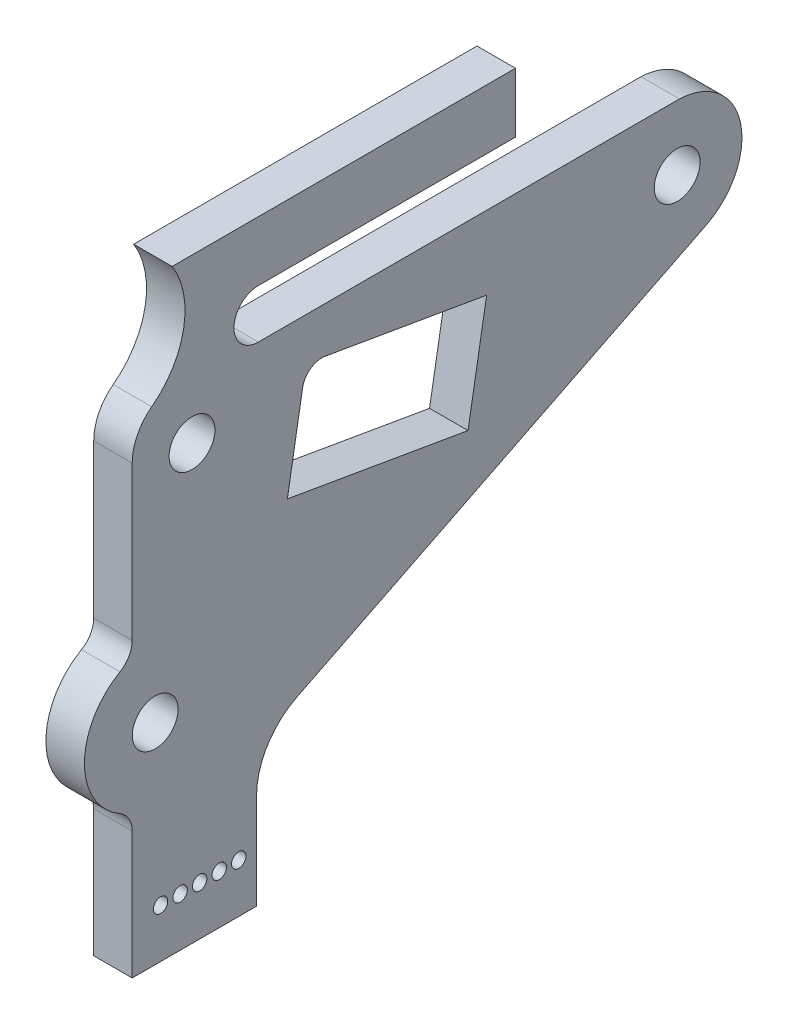
from build123d import *

# Parameters (mm, degrees)
SKETCH1_R           = 2.38125
SKETCH1_R_2         = 0.75
BOSS_EXTRUDE1_DEPTH = 2


with BuildPart() as part:
    # Sketch1 → Boss-Extrude1 (new, symmetric)
    with BuildSketch(Plane(origin=(0, 0, 0), x_dir=(0, 0, -1), z_dir=(1, 0, 0))):
        with BuildLine():
            Line((-56.625400227, 2.386991318), (-56.625400227, -13.559221537))
            ThreePointArc((-56.625400227, -13.559221537), (-56.966991368, -14.831463057), (-57.899887224, -15.761510537))
            ThreePointArc((-57.899887224, -15.761510537), (-61.589569936, -22.137211246), (-57.899887224, -28.512911956))
            ThreePointArc((-57.899887224, -28.512911956), (-56.966991368, -29.442959435), (-56.625400227, -30.715200956))
            Line((-56.625400227, -30.715200956), (-56.625400227, -43.943749635))
            Line((-56.625400227, -43.943749635), (-43.707520647, -43.943749635))
            Line((-43.707520647, -43.943749635), (-43.707520647, -34.030414011))
            ThreePointArc((-43.707520647, -34.030414011), (-42.567322793, -30.020854914), (-39.487950002, -27.21121463))
            Line((-39.487950002, -27.21121463), (-25.808814493, -20.390042329))
            Line((-25.808814493, -20.390042329), (3.003273, -6.022744555))
            ThreePointArc((3.003273, -6.022744555), (6.576528363, 1.429116992), (0.23290188, 6.72598375))
            Line((0.23290188, 6.72598375), (-43.515144264, 6.72598375))
            ThreePointArc((-43.515144264, 6.72598375), (-46.055144264, 9.26598375), (-43.515144264, 11.80598375))
            Line((-43.515144264, 11.80598375), (-16.803992093, 11.80598375))
            Line((-16.803992093, 11.80598375), (-16.803992093, 18.009025029))
            Line((-16.803992093, 18.009025029), (-52.475776529, 18.009025029))
            ThreePointArc((-52.475776529, 18.009025029), (-51.277962728, 11.814262359), (-54.597011148, 6.44828062))
            ThreePointArc((-54.597011148, 6.44828062), (-56.090099528, 4.65681692), (-56.625400227, 2.386991318))
        make_face()
        Circle(SKETCH1_R, mode=Mode.SUBTRACT)
        with Locations((-45.553086475, -38.863749635)):
            Circle(SKETCH1_R_2, mode=Mode.SUBTRACT)
        with Locations((-47.585086475, -38.863749635)):
            Circle(SKETCH1_R_2, mode=Mode.SUBTRACT)
        with Locations((-49.617086475, -38.863749635)):
            Circle(SKETCH1_R_2, mode=Mode.SUBTRACT)
        with Locations((-51.649086475, -38.863749635)):
            Circle(SKETCH1_R_2, mode=Mode.SUBTRACT)
        with Locations((-54.236184525, -22.137211246)):
            Circle(SKETCH1_R, mode=Mode.SUBTRACT)
        with Locations((-50.410128911, 1.079375692)):
            Circle(SKETCH1_R, mode=Mode.SUBTRACT)
        with Locations((-53.681086475, -38.863749635)):
            Circle(SKETCH1_R_2, mode=Mode.SUBTRACT)
        with BuildLine():
            Line((-36.568397511, 1.976008906), (-19.797694446, -0.914638547))
            Line((-19.797694446, -0.914638547), (-21.730897843, -12.13052726))
            Line((-21.730897843, -12.13052726), (-40.504072916, -8.894727872))
            Line((-40.504072916, -8.894727872), (-38.916021454, 0.318688833))
            ThreePointArc((-38.916021454, 0.318688833), (-38.085451708, 1.633557707), (-36.568397511, 1.976008906))
        make_face(mode=Mode.SUBTRACT)
    extrude(amount=BOSS_EXTRUDE1_DEPTH, both=True)


solid = part.part
